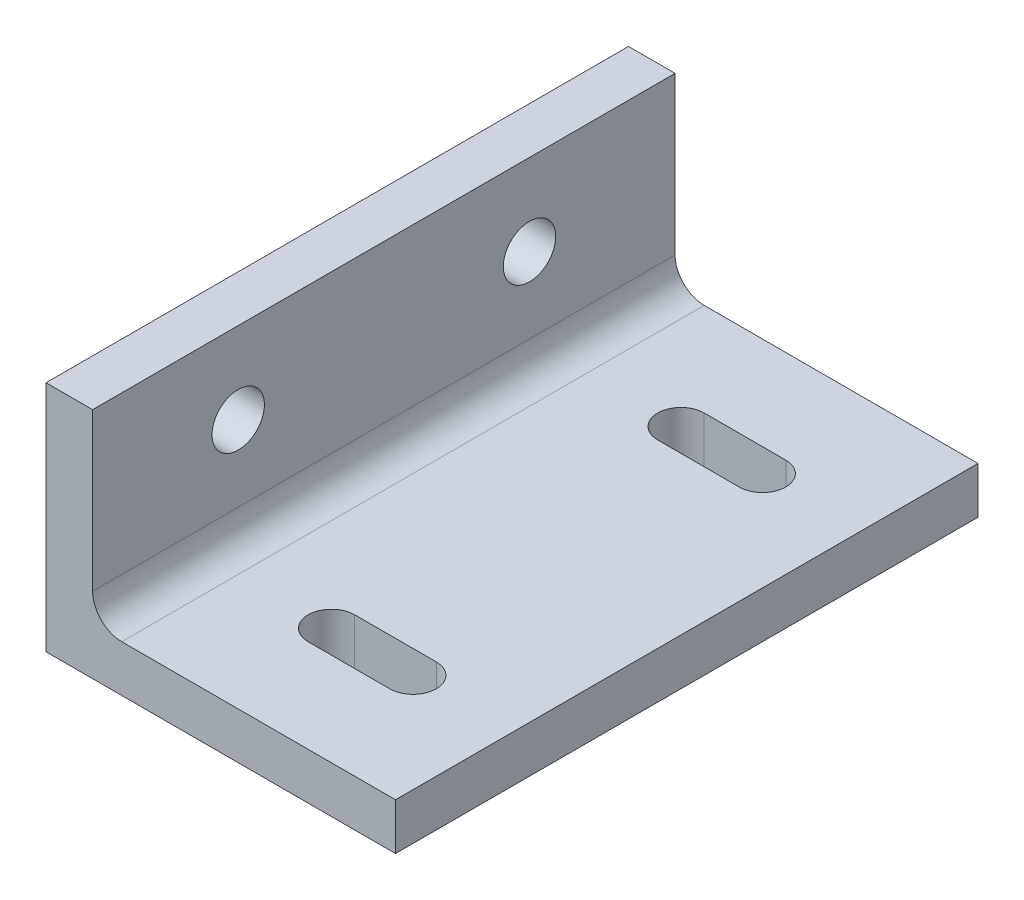
from build123d import *

# Parameters (mm, degrees)
EXTRUDE_1_DEPTH     = 100
CUT_EXTRUDE_3_DEPTH = 121.929731663
SKETCH_4_R          = 4.5
CUT_EXTRUDE_4_DEPTH = 124.288280059


with BuildPart() as part:
    # 草图1 → 凸台-拉伸1 (new body)
    with BuildSketch(Plane.XY):
        with BuildLine():
            Line((0, 0), (60, 0))
            Line((60, 0), (60, 8))
            Line((60, 8), (13, 8))
            ThreePointArc((13, 8), (9.4645, 9.4645), (8, 13))
            Line((8, 13), (8, 40))
            Line((8, 40), (0, 40))
            Line((0, 40), (0, 0))
        make_face()
    extrude(amount=EXTRUDE_1_DEPTH)

    # 草图3 → 切除-拉伸3 (cut, through all)
    with BuildSketch(Plane(origin=(0, 8, 0), x_dir=(1, 0, 0), z_dir=(0, 1, 0))):
        with BuildLine():
            Line((29, -16), (43, -16))
            ThreePointArc((43, -16), (47, -20), (43, -24))
            Line((43, -24), (29, -24))
            ThreePointArc((29, -24), (25, -20), (29, -16))
        make_face()
        with BuildLine():
            Line((29, -76), (43, -76))
            ThreePointArc((43, -76), (47, -80), (43, -84))
            Line((43, -84), (29, -84))
            ThreePointArc((29, -84), (25, -80), (29, -76))
        make_face()
    extrude(amount=-CUT_EXTRUDE_3_DEPTH, mode=Mode.SUBTRACT)

    # 草图4 → 切除-拉伸4 (cut, through all)
    with BuildSketch(Plane(origin=(0, 0, 0), x_dir=(0, 0, -1), z_dir=(1, 0, 0))):
        with Locations(Location((-25, 26, 0), (0, 0, 180))):
            Circle(SKETCH_4_R)
        with Locations(Location((-75, 26, 0), (0, 0, 180))):
            Circle(SKETCH_4_R)
    extrude(amount=CUT_EXTRUDE_4_DEPTH, mode=Mode.SUBTRACT)


solid = part.part
